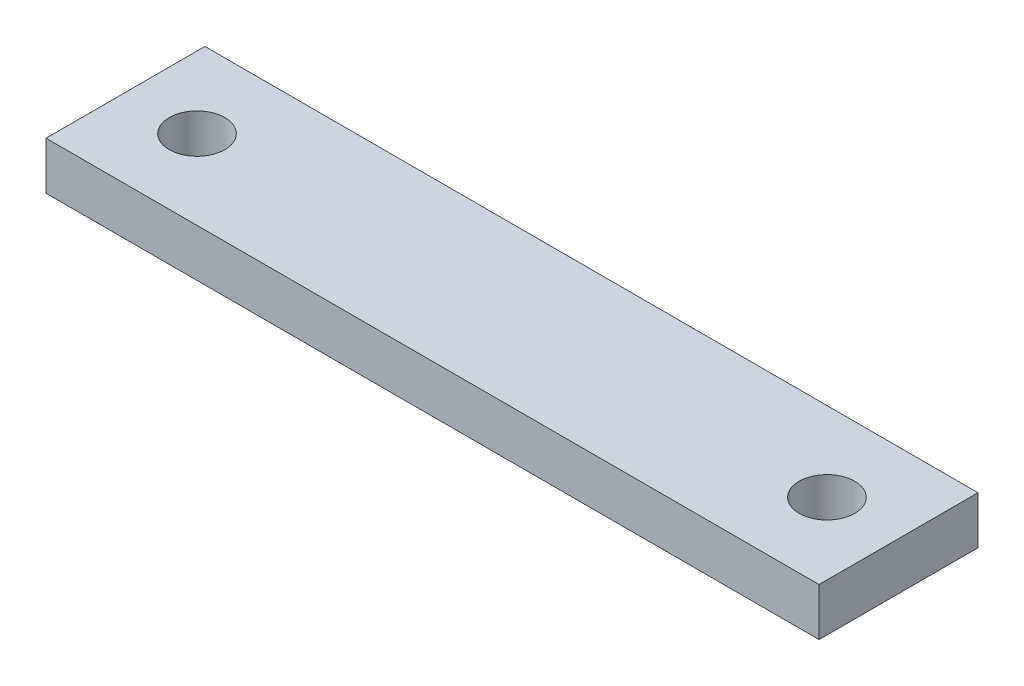
from build123d import *

# Parameters (mm, degrees)
SKETCH1_W           = 48.63
SKETCH1_H           = 10
BOSS_EXTRUDE1_DEPTH = 3
SKETCH2_R           = 1.75
CUT_EXTRUDE1_DEPTH  = 26.004384116


with BuildPart() as part:
    # Sketch1 → Boss-Extrude1 (new body)
    with BuildSketch(Plane(origin=(0, 0, 0), x_dir=(1, 0, 0), z_dir=(0, 1, 0))):
        Rectangle(SKETCH1_W, SKETCH1_H)
    extrude(amount=BOSS_EXTRUDE1_DEPTH)

    # Sketch2 → Cut-Extrude1 (cut, through all)
    with BuildSketch(Plane(origin=(0, 3, 0), x_dir=(1, 0, 0), z_dir=(0, 1, 0))):
        with Locations(Location((-19.815, 0, 0), (0, 0, 270))):
            Circle(SKETCH2_R)
        with Locations(Location((19.8134862, 0, 0), (0, 0, 270))):
            Circle(SKETCH2_R)
    extrude(amount=-CUT_EXTRUDE1_DEPTH, mode=Mode.SUBTRACT)


solid = part.part
